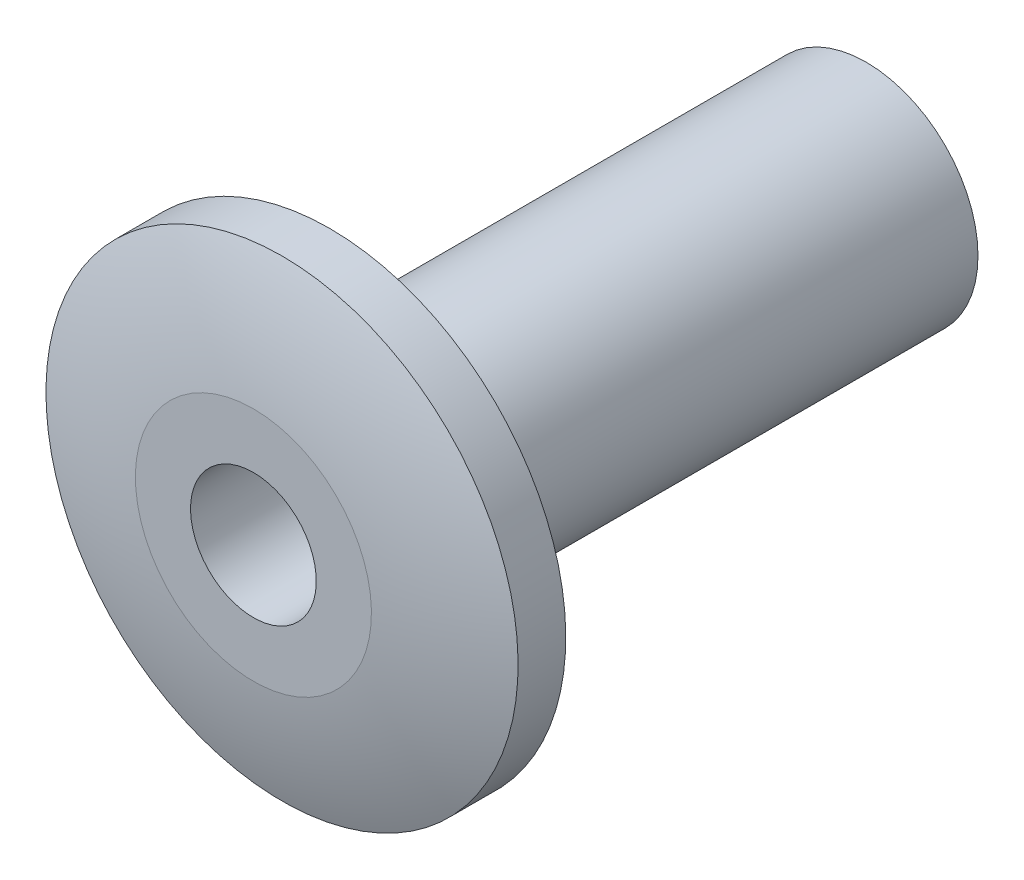
from build123d import *


with BuildPart() as part:
    # Sketch2 → Revolve1 (revolve)
    with BuildSketch(Plane(origin=(0, 0, 0), x_dir=(0, 0, -1), z_dir=(1, 0, 0))):
        with BuildLine():
            Line((5.715, 1.190625), (0, 1.190625))
            Line((0, 1.190625), (0, 2.5146))
            Line((0, 2.5146), (-0.508, 2.5146))
            ThreePointArc((-0.508, 2.5146), (-0.697387383, 1.894916638), (-0.8128, 1.2573))
            Line((-0.8128, 1.2573), (-0.8128, 0.669726563))
            Line((-0.8128, 0.669726563), (0, 0.669726563))
            Line((0, 0.669726563), (0.5715, 0.669726563))
            Line((0.5715, 0.669726563), (0.5715, 0))
            Line((0.5715, 0), (5.715, 0))
            Line((5.715, 0), (5.715, 1.190625))
        make_face()
    revolve(axis=Axis((0, 0, -5.715), (0, 0, 1)))


solid = part.part
